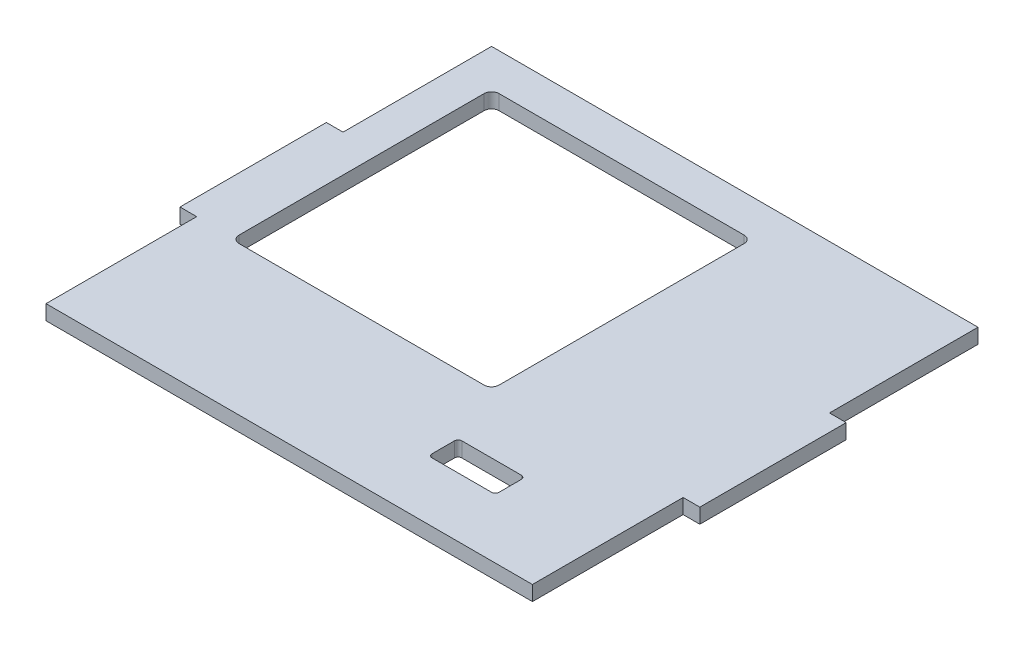
from build123d import *

# Parameters (mm, degrees)
BOSS_EXTRUDE1_DEPTH = 4
CUT_EXTRUDE1_DEPTH  = 5


with BuildPart() as part:
    # Sketch1 → Boss-Extrude1 (new body)
    with BuildSketch(Plane(origin=(0, 0, 0), x_dir=(1, 0, 0), z_dir=(0, 1, 0))):
        Polygon((-65.5, 20), (-70, 20), (-70, -19.415515436), (-65.5, -19.415515436), (-65.5, -60), (65.5, -60), (65.5, -19.415515436), (70, -19.415515436), (70, 20), (65.5, 20), (65.5, 60), (-65.5, 60), align=None)
    extrude(amount=BOSS_EXTRUDE1_DEPTH)

    # Sketch2 → Cut-Extrude1 (cut)
    with BuildSketch(Plane(origin=(0, 4, 0), x_dir=(1, 0, 0), z_dir=(0, 1, 0))):
        with BuildLine():
            Line((-53.5, -20), (12.5, -20))
            ThreePointArc((12.5, -20), (13.914213562, -19.414213562), (14.5, -18))
            Line((14.5, -18), (14.5, 48))
            ThreePointArc((14.5, 48), (13.914213562, 49.414213562), (12.5, 50))
            Line((12.5, 50), (-53.5, 50))
            ThreePointArc((-53.5, 50), (-54.914213562, 49.414213562), (-55.5, 48))
            Line((-55.5, 48), (-55.5, -18))
            ThreePointArc((-55.5, -18), (-54.914213562, -19.414213562), (-53.5, -20))
        make_face()
        with BuildLine():
            Line((22.5, -44), (38.5, -44))
            ThreePointArc((38.5, -44), (39.207106781, -43.707106781), (39.5, -43))
            Line((39.5, -43), (39.5, -37))
            ThreePointArc((39.5, -37), (39.207106781, -36.292893219), (38.5, -36))
            Line((38.5, -36), (22.5, -36))
            ThreePointArc((22.5, -36), (21.792893219, -36.292893219), (21.5, -37))
            Line((21.5, -37), (21.5, -43))
            ThreePointArc((21.5, -43), (21.792893219, -43.707106781), (22.5, -44))
        make_face()
    extrude(amount=-CUT_EXTRUDE1_DEPTH, mode=Mode.SUBTRACT)


solid = part.part
